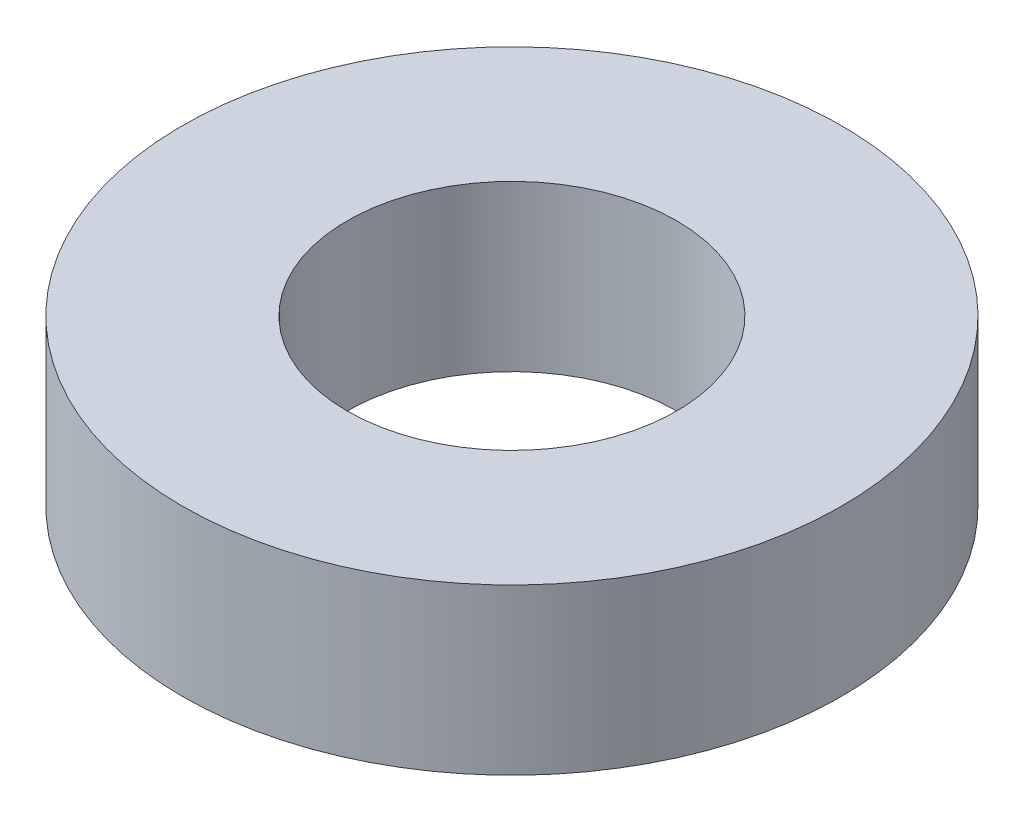
from build123d import *

# Parameters (mm, degrees)
ESQUISSE1_R        = 8
ESQUISSE1_R_2      = 4
BOSS_EXTRU_1_DEPTH = 4


with BuildPart() as part:
    # Esquisse1 → Boss.-Extru.1 (new body)
    with BuildSketch(Plane(origin=(0, 0, 0), x_dir=(1, 0, 0), z_dir=(0, 1, 0))):
        with Locations(Location((0, 0, 0), (0, 0, 270))):
            Circle(ESQUISSE1_R)
        with Locations(Location((0, 0, 0), (0, 0, 270))):
            Circle(ESQUISSE1_R_2, mode=Mode.SUBTRACT)
    extrude(amount=BOSS_EXTRU_1_DEPTH)


solid = part.part
